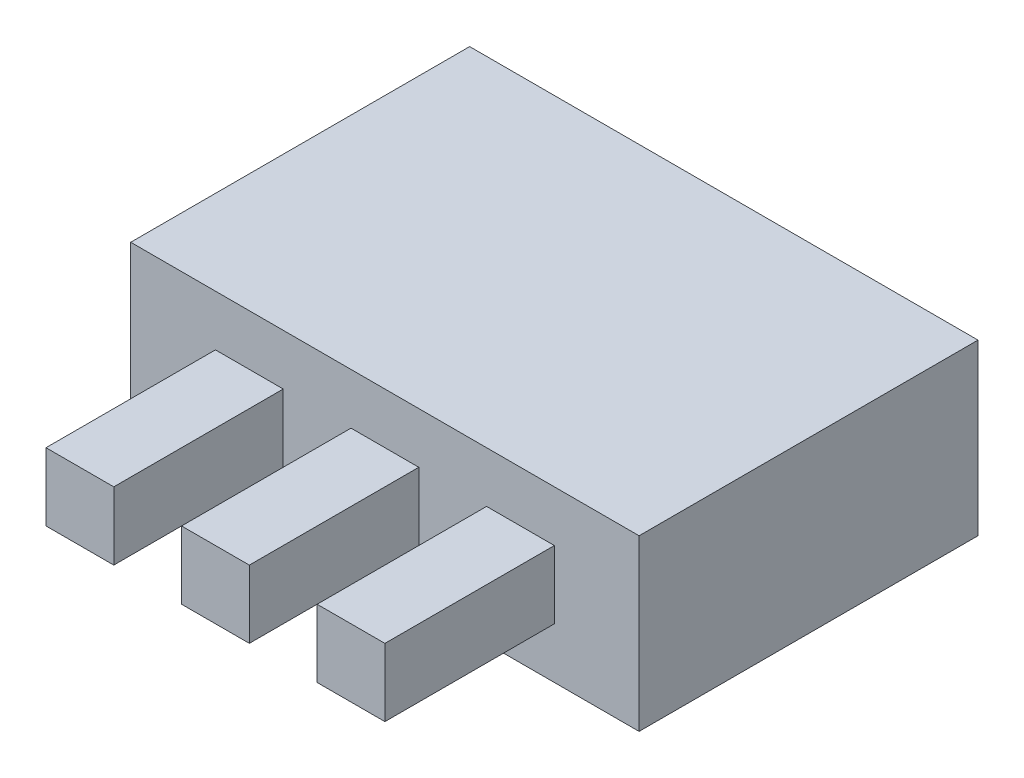
from build123d import *

# Parameters (mm, degrees)
SKETCH_1_W      = 15
SKETCH_1_H      = 5
EXTRUDE_1_DEPTH = 10
SKETCH_1_3_W    = 2
SKETCH_1_3_H    = 2
EXTRUDE_2_DEPTH = 15


with BuildPart() as part:
    # 草图1 → 凸台-拉伸1 (new body)
    with BuildSketch(Plane.XY):
        Rectangle(SKETCH_1_W, SKETCH_1_H)
    extrude(amount=EXTRUDE_1_DEPTH)

    # 草图1<3> → 凸台-拉伸2 (add)
    with BuildSketch(Plane.XY):
        with Locations((4, 0)):
            Rectangle(SKETCH_1_3_W, SKETCH_1_3_H)
        Rectangle(SKETCH_1_3_W, SKETCH_1_3_H)
        with Locations((-4, 0)):
            Rectangle(SKETCH_1_3_W, SKETCH_1_3_H)
    extrude(amount=EXTRUDE_2_DEPTH)


solid = part.part
